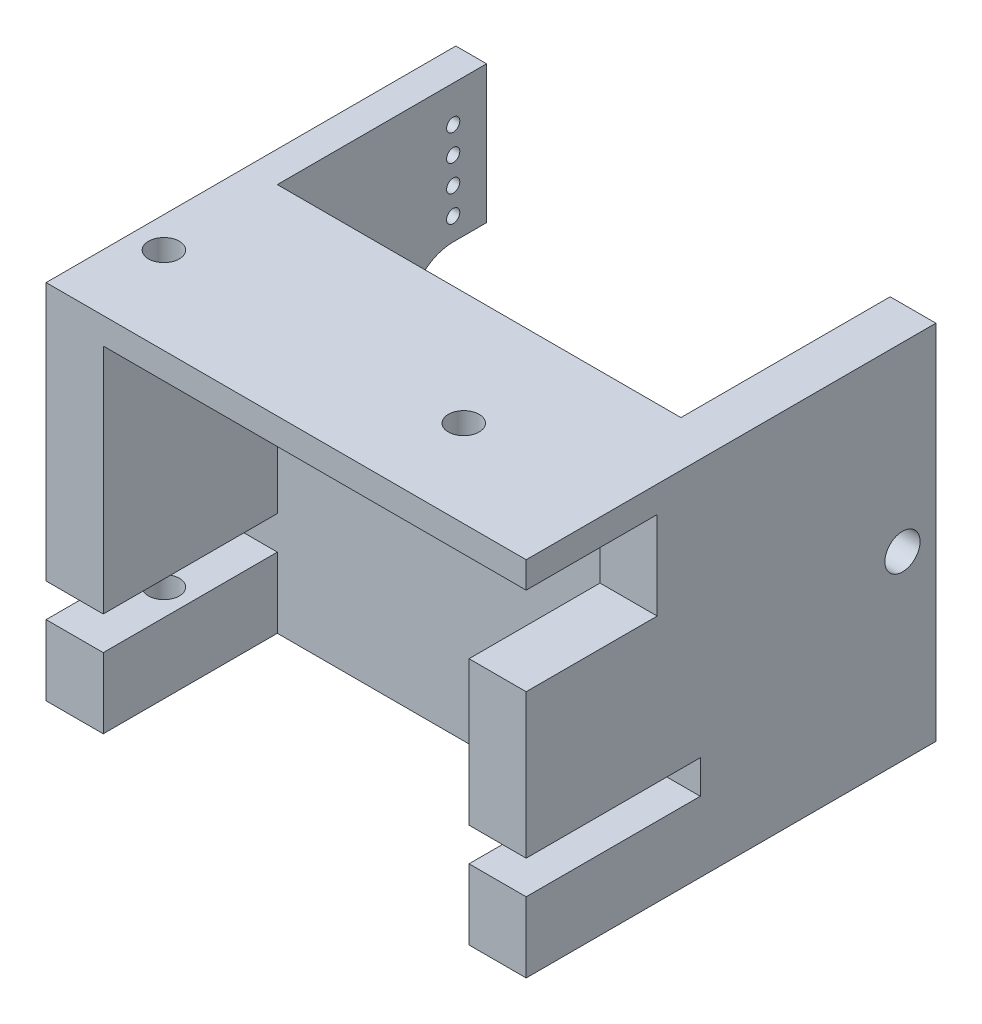
from build123d import *

# Parameters (mm, degrees)
EXTRUDE_1_DEPTH     = 19.8
SKETCH_1_W          = 6.5
SKETCH_1_H          = 8
EXTRUDE_1_2_DEPTH   = 19.8
EXTRUDE_1_3_DEPTH   = 19.8
SKETCH_2_W          = 54.6
SKETCH_2_H          = 41.2
EXTRUDE_2_DEPTH     = 3
SKETCH_4_R          = 0.75
EXTRUDE_3_DEPTH     = 3.5
SKETCH_5_W          = 23.8
SKETCH_5_H          = 41.2
EXTRUDE_4_DEPTH     = 5.2
SKETCH_6_R          = 1.75
CUT_EXTRUDE_2_DEPTH = 8
CUT_EXTRUDE_START   = -8
SKETCH_7_R          = 1.75
CUT_EXTRUDE_3_DEPTH = 8
SKETCH_9_R          = 2
CUT_EXTRUDE_4_DEPTH = 10
SKETCH_10_W         = 14.9
SKETCH_10_H         = 10
CUT_EXTRUDE_5_DEPTH = 7


with BuildPart() as part:
    # 草圖1 → 填料-伸長1 (new body)
    with BuildSketch(Plane.XY):
        Polygon((-48.1, 39.2), (-48.1, 12.8), (-54.6, 12.8), (-54.6, 42.2), (-47.6, 42.2), (-7, 42.2), (0, 42.2), (0, 12.8), (-6.5, 12.8), (-6.5, 39.2), align=None)
    extrude(amount=EXTRUDE_1_DEPTH)



with BuildPart() as body_2:
    # 草圖1 → Extrude 1 2 (new body)
    with BuildSketch(Plane.XY):
        with Locations((-3.25, 5)):
            Rectangle(SKETCH_1_W, SKETCH_1_H)
    extrude(amount=EXTRUDE_1_2_DEPTH)


with BuildPart() as body_3:
    # 草圖1 → Extrude 1 3 (new body)
    with BuildSketch(Plane.XY):
        with Locations((-51.35, 5)):
            Rectangle(SKETCH_1_W, SKETCH_1_H)
    extrude(amount=EXTRUDE_1_3_DEPTH)


with BuildPart() as part_1:
    add(part.part)

    add(body_2.part)  # 填料-伸長2 merges body 2

    add(body_3.part)  # 填料-伸長2 merges body 3
    # 草圖2 → 填料-伸長2 (add)
    with BuildSketch(Plane(origin=(0, 0, 0), x_dir=(-1, 0, 0), z_dir=(0, 0, -1))):
        with Locations((27.3, 21.6)):
            Rectangle(SKETCH_2_W, SKETCH_2_H)
    extrude(amount=EXTRUDE_2_DEPTH)

    # 草圖4 → 填料-伸長3 (add)
    with BuildSketch(Plane(origin=(-54.6, 54.6, 0), x_dir=(0, -1, 0), z_dir=(1, 0, 0))):
        with BuildLine():
            Line((12.4, 26.8), (28.05, 26.8))
            Line((28.05, 26.8), (28.05, 23))
            ThreePointArc((28.05, 23), (33, 18.05), (37.95, 23))
            Line((37.95, 23), (37.95, 26.8))
            Line((37.95, 26.8), (53.6, 26.8))
            Line((53.6, 26.8), (53.6, 23))
            Line((53.6, 23), (53.6, 3))
            Line((53.6, 3), (12.4, 3))
            Line((12.4, 3), (12.4, 23))
            Line((12.4, 23), (12.4, 26.8))
        make_face()
        with Locations(Location((40.5, 23, 0), (0, 0, 90))):
            Circle(SKETCH_4_R, mode=Mode.SUBTRACT)
        with Locations(Location((43.5, 23, 0), (0, 0, 90))):
            Circle(SKETCH_4_R, mode=Mode.SUBTRACT)
        with Locations(Location((46.5, 23, 0), (0, 0, 90))):
            Circle(SKETCH_4_R, mode=Mode.SUBTRACT)
        with Locations(Location((49.5, 23, 0), (0, 0, 90))):
            Circle(SKETCH_4_R, mode=Mode.SUBTRACT)
        with Locations(Location((16.5, 23, 0), (0, 0, 270))):
            Circle(SKETCH_4_R, mode=Mode.SUBTRACT)
        with Locations(Location((19.5, 23, 0), (0, 0, 270))):
            Circle(SKETCH_4_R, mode=Mode.SUBTRACT)
        with Locations(Location((22.5, 23, 0), (0, 0, 270))):
            Circle(SKETCH_4_R, mode=Mode.SUBTRACT)
        with Locations(Location((25.5, 23, 0), (0, 0, 270))):
            Circle(SKETCH_4_R, mode=Mode.SUBTRACT)
    extrude(amount=EXTRUDE_3_DEPTH)

    # 草圖5 → 填料-伸長4 (add)
    with BuildSketch(Plane(origin=(0, 0, 0), x_dir=(0, 0, -1), z_dir=(1, 0, 0))):
        with Locations((14.9, 21.6)):
            Rectangle(SKETCH_5_W, SKETCH_5_H)
    extrude(amount=-EXTRUDE_4_DEPTH)

    # 草圖6 → 除料-伸長2 (cut)
    with BuildSketch(Plane(origin=(0, 1, 0), x_dir=(-1, 0, 0), z_dir=(0, -1, 0))):
        with Locations(Location((51.1, -9.9, 0), (0, 0, 180))):
            Circle(SKETCH_6_R)
    extrude(amount=-CUT_EXTRUDE_2_DEPTH, mode=Mode.SUBTRACT)

    # 草圖7 → 除料-伸長3 (cut)
    with BuildSketch(Plane(origin=(0, 42.2, 0), x_dir=(1, 0, 0), z_dir=(0, 1, 0)).offset(CUT_EXTRUDE_START)):
        with Locations((-51.1, -9.9)):
            Circle(SKETCH_7_R)
        with Locations(Location((-17, -9.9, 0), (0, 0, 270))):
            Circle(SKETCH_7_R)
    extrude(amount=CUT_EXTRUDE_3_DEPTH, mode=Mode.SUBTRACT)

    # 草圖9 → 除料-伸長4 (cut)
    with BuildSketch(Plane(origin=(0, 0, 0), x_dir=(0, 0, -1), z_dir=(1, 0, 0))):
        with Locations(Location((23, 21.6, 0), (0, 0, 90))):
            Circle(SKETCH_9_R)
    extrude(amount=-CUT_EXTRUDE_4_DEPTH, mode=Mode.SUBTRACT)

    # 草圖10 → 除料-伸長5 (cut)
    with BuildSketch(Plane(origin=(0, 0, 0), x_dir=(0, 0, -1), z_dir=(1, 0, 0))):
        with Locations((-12.35, 34.2)):
            Rectangle(SKETCH_10_W, SKETCH_10_H)
    extrude(amount=-CUT_EXTRUDE_5_DEPTH, mode=Mode.SUBTRACT)


solid = part_1.part
